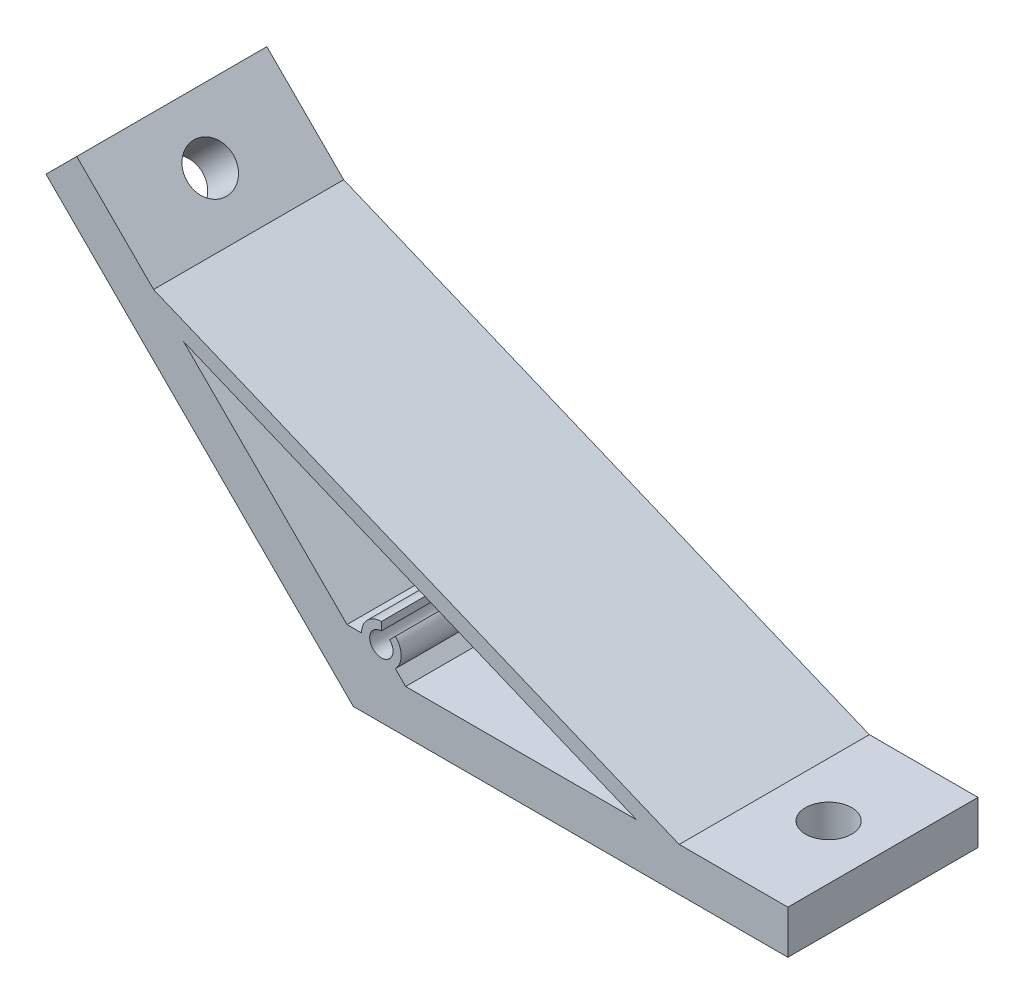
from build123d import *

# Parameters (mm, degrees)
EXTRUDE_1_DEPTH     = 17.5
SKETCH_3_R          = 4.25
CUT_EXTRUDE_1_DEPTH = 99.217328675


with BuildPart() as part:
    # 草图1 → 凸台-拉伸1 (new, symmetric)
    with BuildSketch(Plane.XY):
        Polygon((80, 0), (0, 0), (-56.568542495, 56.568542495), (-50.911688245, 62.225396744), (-36.769552622, 48.083261121), (60, 8), (80, 8), align=None)
        with BuildLine():
            Line((52.160622211, 8), (9.638600026, 8))
            Line((9.638600026, 8), (7.747166088, 9.891433938))
            ThreePointArc((7.747166088, 9.891433938), (8.816226337, 12.472373689), (7.747166088, 15.05331344))
            Line((7.747166088, 15.05331344), (6.686505916, 13.992653268))
            ThreePointArc((6.686505916, 13.992653268), (4.343456957, 10.486032694), (5.166226337, 14.622373689))
            Line((5.166226337, 14.622373689), (5.166226337, 16.122373689))
            ThreePointArc((5.166226337, 16.122373689), (2.585286586, 15.05331344), (1.516226337, 12.472373689))
            Line((1.516226337, 12.472373689), (-1.15866519, 12.472373689))
            Line((-1.15866519, 12.472373689), (-31.226275427, 42.539983926))
            Line((-31.226275427, 42.539983926), (52.160622211, 8))
        make_face(mode=Mode.SUBTRACT)
    extrude(amount=EXTRUDE_1_DEPTH, both=True)

    # 草图3 → 切除-拉伸1 (cut, through all)
    with BuildSketch(Plane(origin=(0, 8, 0), x_dir=(1, 0, 0), z_dir=(0, 1, 0))):
        with Locations(Location((70, 0, 0), (0, 0, 180))):
            Circle(SKETCH_3_R)
    cut_extrude_1 = extrude(amount=-CUT_EXTRUDE_1_DEPTH, mode=Mode.SUBTRACT)

    # 镜向1: 切除-拉伸1 across plane
    add(cut_extrude_1.mirror(Plane(origin=(0, 0, 0), x_dir=(0, 0, 1), z_dir=(-0.9238795325112867, 0.3826834323650898, 0))), mode=Mode.SUBTRACT)


solid = part.part
